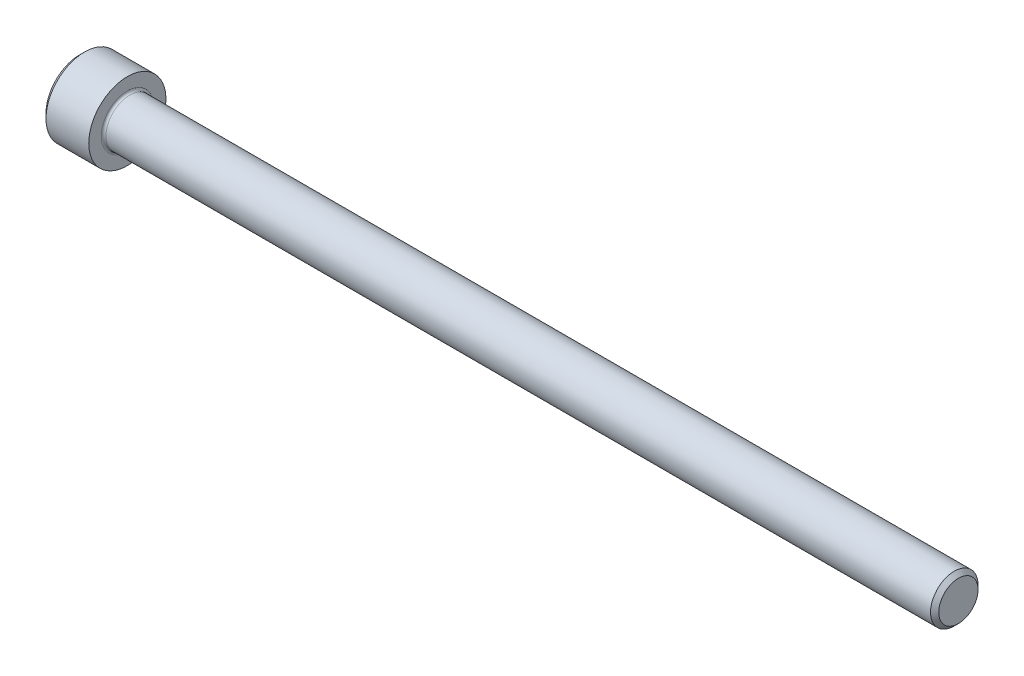
from build123d import *

# Parameters (mm, degrees)
FILLET1_R   = 0.4
HEX_2_DEPTH = 4


with BuildPart() as part:
    # BodySke → Base-Revolve (revolve)
    with BuildSketch(Plane.XY, mode=Mode.PRIVATE) as base_revolve_sk:
        Polygon((0, 0), (0, 5.7), (0.8, 6.5), (8, 6.5), (8, 4), (147.3095, 4), (148, 3.3095), (148, 0), align=None)
    revolve(base_revolve_sk.sketch.rotate(Axis((-31.75, 0, 0), (1, 0, 0)), 90), axis=Axis((-31.75, 0, 0), (1, 0, 0)))

    # Fillet1
    fillet1_edges = [part.edges().sort_by_distance(p)[0] for p in [
        (8, 0, -4),
    ]]
    fillet(fillet1_edges, radius=FILLET1_R)

    # Sketch2 → Hex-PreBroach (revolve, cut)
    with BuildSketch(Plane.XY, mode=Mode.PRIVATE) as hex_prebroach_sk:
        Polygon((0, 3.0475), (4, 3.0475), (5.759474945, 0), (0, 0), align=None)
    revolve(hex_prebroach_sk.sketch.rotate(Axis((0, 0, 0), (1, 0, 0)), 90), axis=Axis((0, 0, 0), (1, 0, 0)), mode=Mode.SUBTRACT)

    # Sketch3 → Hex 2 (cut)
    with BuildSketch(Plane(origin=(0, 0, 0), x_dir=(0, 0.500000000000001, 0.866025403784438), z_dir=(-1, 0, 0))):
        Polygon((1.759474945, 3.0475), (-1.759474945, 3.0475), (-3.518949891, 0), (-1.759474945, -3.0475), (1.759474945, -3.0475), (3.518949891, 0), align=None)
    extrude(amount=-HEX_2_DEPTH, mode=Mode.SUBTRACT)


solid = part.part
